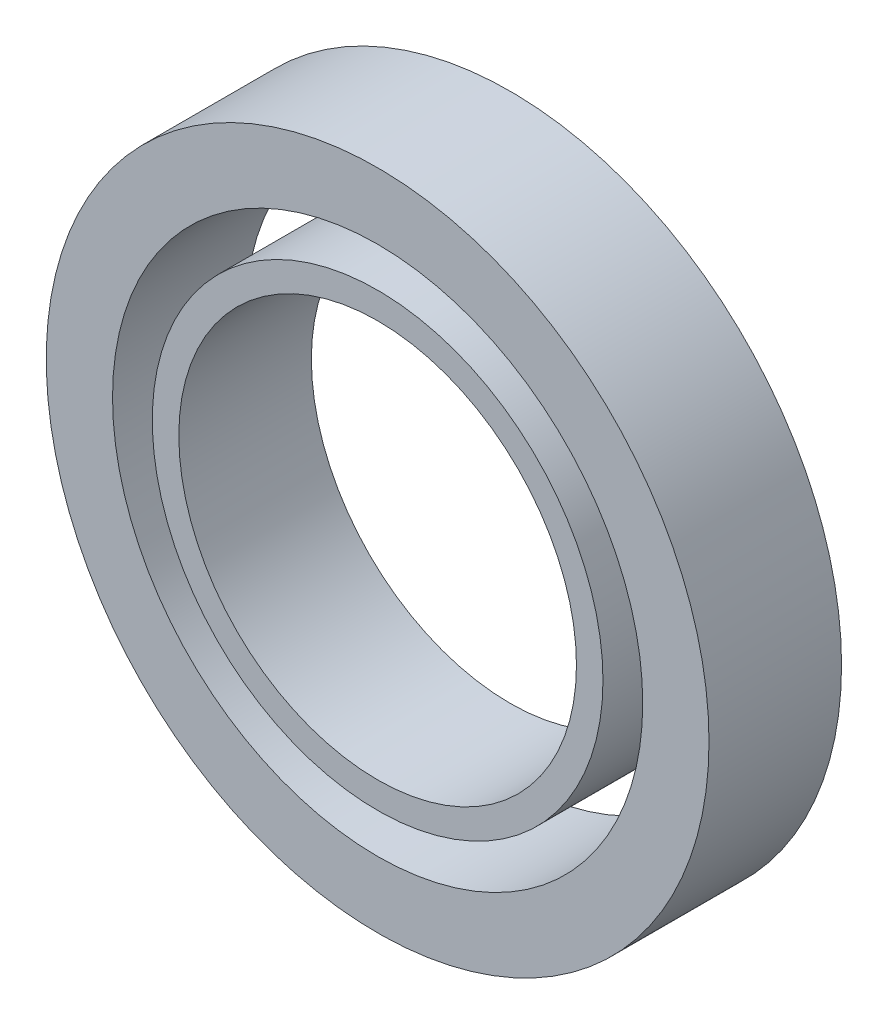
from build123d import *

# Parameters (mm, degrees)
SKETCH1_R           = 2.5
SKETCH1_R_2         = 2
BOSS_EXTRUDE1_DEPTH = 1
SKETCH2_R           = 1.7
SKETCH2_R_2         = 1.5
BOSS_EXTRUDE2_DEPTH = 1


with BuildPart() as part:
    # Sketch1 → Boss-Extrude1 (new body)
    with BuildSketch(Plane.XY):
        Circle(SKETCH1_R)
        Circle(SKETCH1_R_2, mode=Mode.SUBTRACT)
    extrude(amount=BOSS_EXTRUDE1_DEPTH)


with BuildPart() as body_2:
    # Sketch2 → Boss-Extrude2 (new body)
    with BuildSketch(Plane.XY):
        Circle(SKETCH2_R)
        Circle(SKETCH2_R_2, mode=Mode.SUBTRACT)
    extrude(amount=BOSS_EXTRUDE2_DEPTH)


solid = Compound([part.part, body_2.part])
